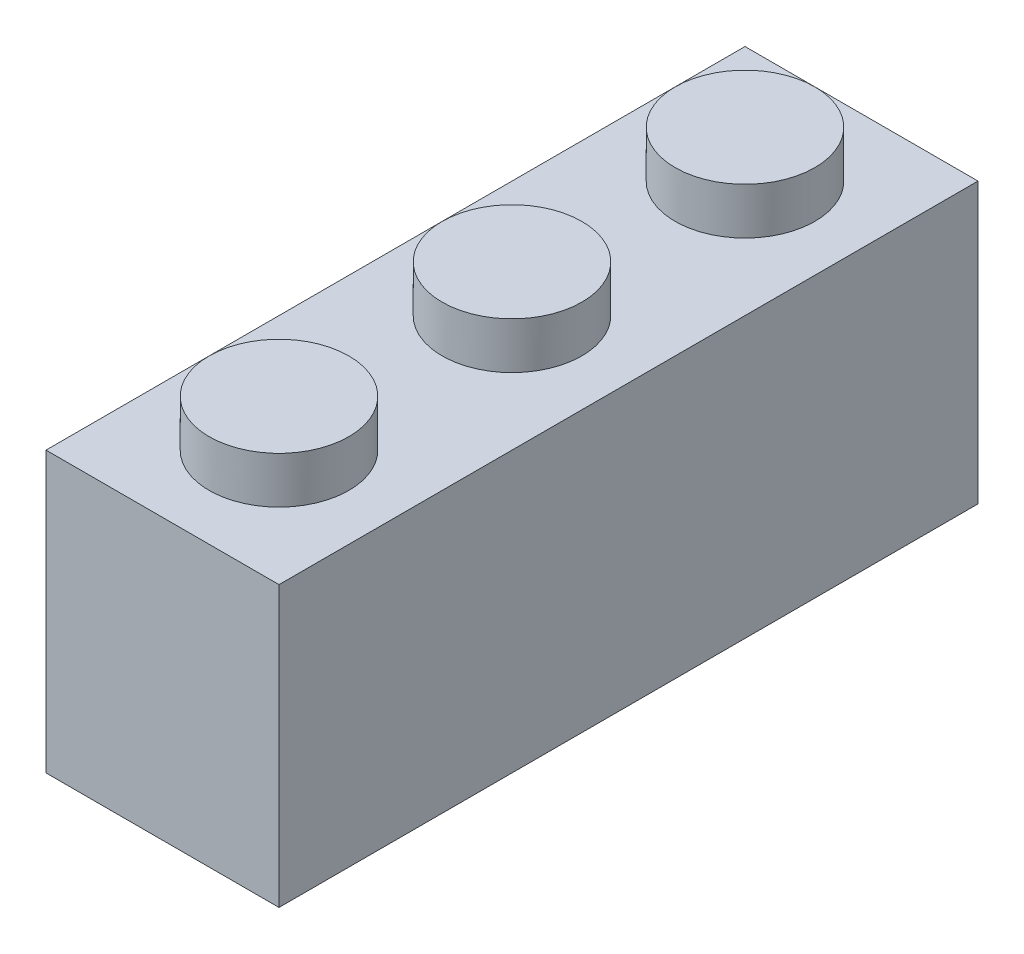
from build123d import *

# Parameters (mm, degrees)
SKETCH1_W            = 8
SKETCH1_H            = 24
BOSS_EXTRUDE1_DEPTH  = 9.6
SKETCH2_R            = 2.4
BOSS_EXTRUDE2_DEPTH  = 1.6
LPATTERN1_COUNT      = 2
LPATTERN1_PITCH      = 8
LPATTERN1_COUNT_DIR2 = 4
LPATTERN1_PITCH_DIR2 = 8
SHELL1_T             = -1.6


with BuildPart() as part:
    # Sketch1 → Boss-Extrude1 (new body)
    with BuildSketch(Plane(origin=(0, 0, 0), x_dir=(1, 0, 0), z_dir=(0, 1, 0))):
        with Locations((4, 12)):
            Rectangle(SKETCH1_W, SKETCH1_H)
    extrude(amount=BOSS_EXTRUDE1_DEPTH)

    # Sketch2 → Boss-Extrude2 (add)
    with BuildSketch(Plane(origin=(0, 9.6, 0), x_dir=(1, 0, 0), z_dir=(0, 1, 0))):
        with Locations(Location((4, 4, 0), (0, 0, 90))):
            Circle(SKETCH2_R)
    boss_extrude2 = extrude(amount=BOSS_EXTRUDE2_DEPTH)

    # LPattern1: Boss-Extrude2 2 × 4, 5 skipped
    with Locations(*[(i * LPATTERN1_PITCH, 0, -j * LPATTERN1_PITCH_DIR2) for i in range(LPATTERN1_COUNT) for j in range(LPATTERN1_COUNT_DIR2) if (i, j) not in ((0, 0), (0, 3), (1, 0), (1, 1), (1, 2), (1, 3))]):
        add(boss_extrude2)

    # Shell1
    shell1_openings = [part.faces().sort_by_distance(p)[0] for p in [
        (4, 0, -12),
    ]]
    offset(amount=SHELL1_T, openings=shell1_openings, kind=Kind.INTERSECTION)


solid = part.part
